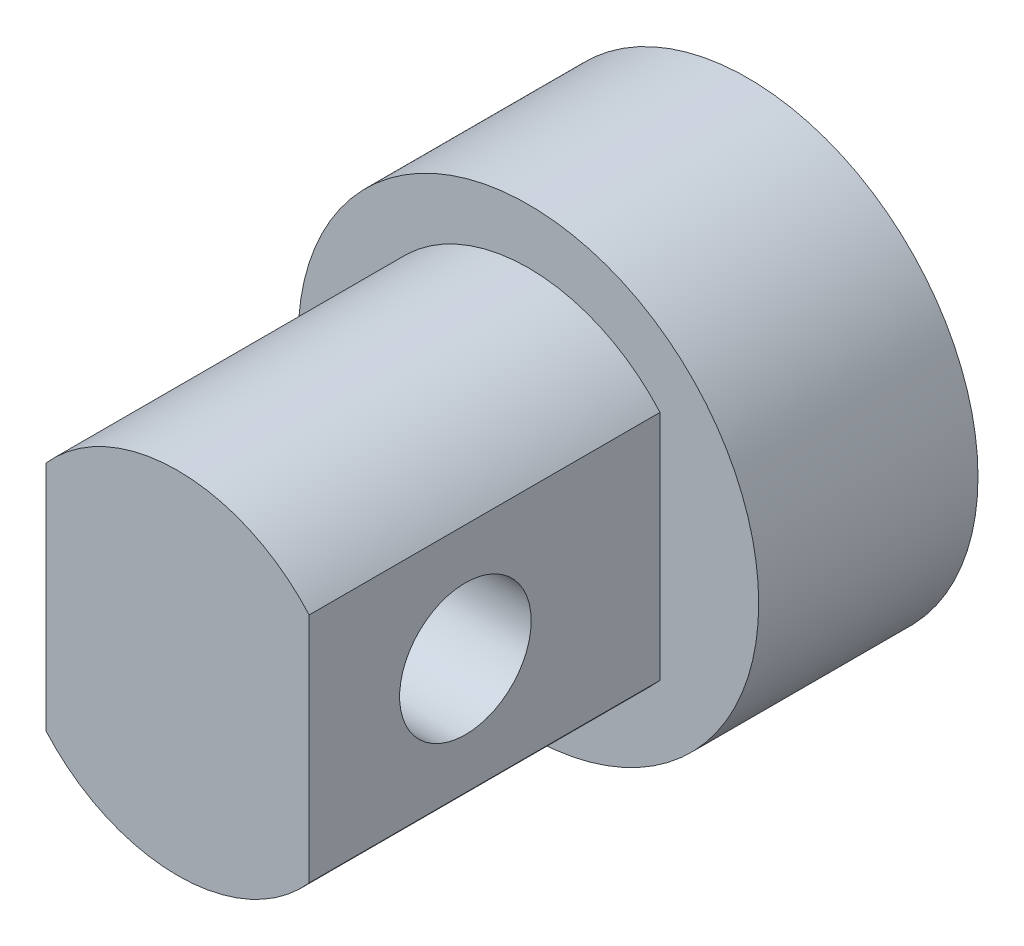
from build123d import *

# Parameters (mm, degrees)
BOSS_EXTRUDE1_DEPTH     = 16
SKETCH2_R               = 10.5
BOSS_EXTRUDE2_DEPTH     = 10
CUT_EXTRUDE1_DEPTH      = 22.828879953
CUT_EXTRUDE1_DEPTH_BACK = 22.828879953
SKETCH3_R               = 3


with BuildPart() as part:
    # Sketch1 → Boss-Extrude1 (new body)
    with BuildSketch(Plane.XY):
        with BuildLine():
            Line((-6, 5.291502622), (-6, -5.291502622))
            ThreePointArc((-6, -5.291502622), (0, -8), (6, -5.291502622))
            Line((6, -5.291502622), (6, 5.291502622))
            ThreePointArc((6, 5.291502622), (0, 8), (-6, 5.291502622))
        make_face()
    extrude(amount=BOSS_EXTRUDE1_DEPTH)

    # Sketch2 → Boss-Extrude2 (add)
    with BuildSketch(Plane.XY):
        Circle(SKETCH2_R)
    extrude(amount=-BOSS_EXTRUDE2_DEPTH)

    # Sketch3 → Cut-Extrude1 (cut, two sides: drawn at the far end of the back side and taken through both)
    with BuildSketch(Plane(origin=(0, 0, 0), x_dir=(0, 0, -1), z_dir=(1, 0, 0)).offset(-CUT_EXTRUDE1_DEPTH_BACK)):
        with Locations((-8.875468428, 0)):
            Circle(SKETCH3_R)
    extrude(amount=CUT_EXTRUDE1_DEPTH + CUT_EXTRUDE1_DEPTH_BACK, mode=Mode.SUBTRACT)


solid = part.part
